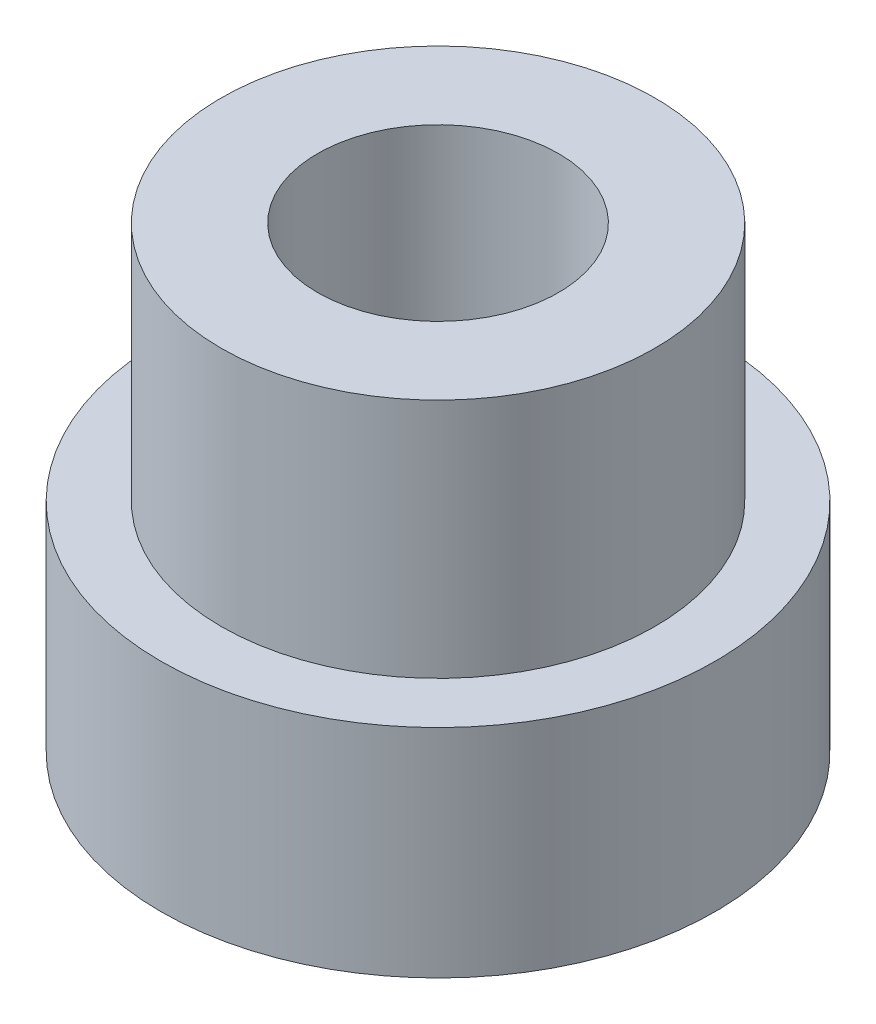
from build123d import *

# Parameters (mm, degrees)
SKETCH1_R              = 23
BOSS_EXTRUDE1_DEPTH    = 18
SKETCH2_R              = 18
BOSS_EXTRUDE2_DEPTH    = 20
SKETCH3_R              = 8
CUT_EXTRUDE1_DEPTH     = 8
SKETCH4_R              = 10
CUT_EXTRUDE2_DEPTH     = 20
F_10_0MM_DOWEL_SLOT1_D = 10


with BuildPart() as part:
    # Sketch1 → Boss-Extrude1 (new body)
    with BuildSketch(Plane(origin=(0, 0, 0), x_dir=(1, 0, 0), z_dir=(0, 1, 0))):
        with Locations(Location((0, 0, 0), (0, 0, 270))):
            Circle(SKETCH1_R)
    extrude(amount=BOSS_EXTRUDE1_DEPTH)

    # Sketch2 → Boss-Extrude2 (add)
    with BuildSketch(Plane(origin=(0, 18, 0), x_dir=(1, 0, 0), z_dir=(0, 1, 0))):
        with Locations(Location((0, 0, 0), (0, 0, 270))):
            Circle(SKETCH2_R)
    extrude(amount=BOSS_EXTRUDE2_DEPTH)

    # Sketch3 → Cut-Extrude1 (cut)
    with BuildSketch(Plane(origin=(0, 0, 0), x_dir=(-1, 0, 0), z_dir=(0, -1, 0))):
        with Locations(Location((0, 0, 0), (0, 0, 90))):
            Circle(SKETCH3_R)
    extrude(amount=-CUT_EXTRUDE1_DEPTH, mode=Mode.SUBTRACT)

    # Sketch4 → Cut-Extrude2 (cut)
    with BuildSketch(Plane(origin=(0, 38, 0), x_dir=(1, 0, 0), z_dir=(0, 1, 0))):
        with Locations(Location((0, 0, 0), (0, 0, 270))):
            Circle(SKETCH4_R)
    extrude(amount=-CUT_EXTRUDE2_DEPTH, mode=Mode.SUBTRACT)

    # Ø10.0mm Dowel Slot1 (through all)
    with Locations(Plane(origin=(0, 18, 0), x_dir=(1, 0, 0), z_dir=(0, 1, 0))):
        with Locations((0, 0)):
            Hole(F_10_0MM_DOWEL_SLOT1_D / 2)


solid = part.part
